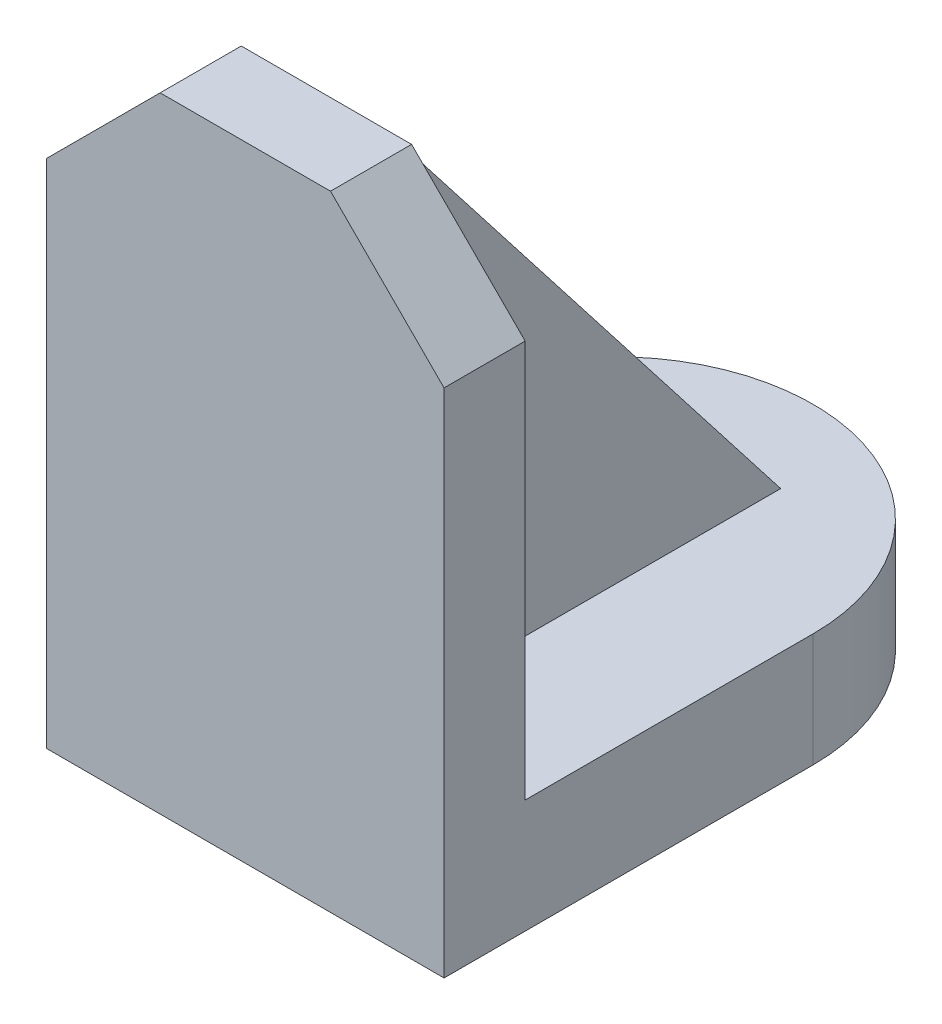
from build123d import *

# Parameters (mm, degrees)
SKETCH1_W           = 42
SKETCH1_H           = 39
BOSS_EXTRUDE1_DEPTH = 12
SKETCH2_W           = 42
SKETCH2_H           = 8.570511372
BOSS_EXTRUDE2_DEPTH = 54
CHAMFER1_SIZE       = 12
BOSS_EXTRUDE3_DEPTH = 6


with BuildPart() as part:
    # Sketch1 → Boss-Extrude1 (new body)
    with BuildSketch(Plane(origin=(0, 0, 0), x_dir=(1, 0, 0), z_dir=(0, 1, 0))):
        Rectangle(SKETCH1_W, SKETCH1_H)
        with BuildLine():
            ThreePointArc((-21, 19.5), (0, 40.5), (21, 19.5))
            Line((21, 19.5), (-21, 19.5))
        make_face()
    extrude(amount=BOSS_EXTRUDE1_DEPTH)

    # Sketch2 → Boss-Extrude2 (add)
    with BuildSketch(Plane(origin=(0, 12, 0), x_dir=(1, 0, 0), z_dir=(0, 1, 0))):
        with Locations((0, -15.214744314)):
            Rectangle(SKETCH2_W, SKETCH2_H)
    extrude(amount=BOSS_EXTRUDE2_DEPTH)

    # Chamfer1
    chamfer1_edges = [part.edges().sort_by_distance(p)[0] for p in [
        (-21, 66, 15.214744314),
        (21, 66, 15.214744314),
    ]]
    chamfer(chamfer1_edges, length=CHAMFER1_SIZE)

    # Sketch5 → Boss-Extrude3 (add, symmetric)
    with BuildSketch(Plane(origin=(0, 0, 0), x_dir=(0, 0, -1), z_dir=(1, 0, 0))):
        Polygon((-10.929488628, 66), (-10.929488628, 12), (31.070511372, 12), align=None)
    extrude(amount=BOSS_EXTRUDE3_DEPTH, both=True)


solid = part.part
